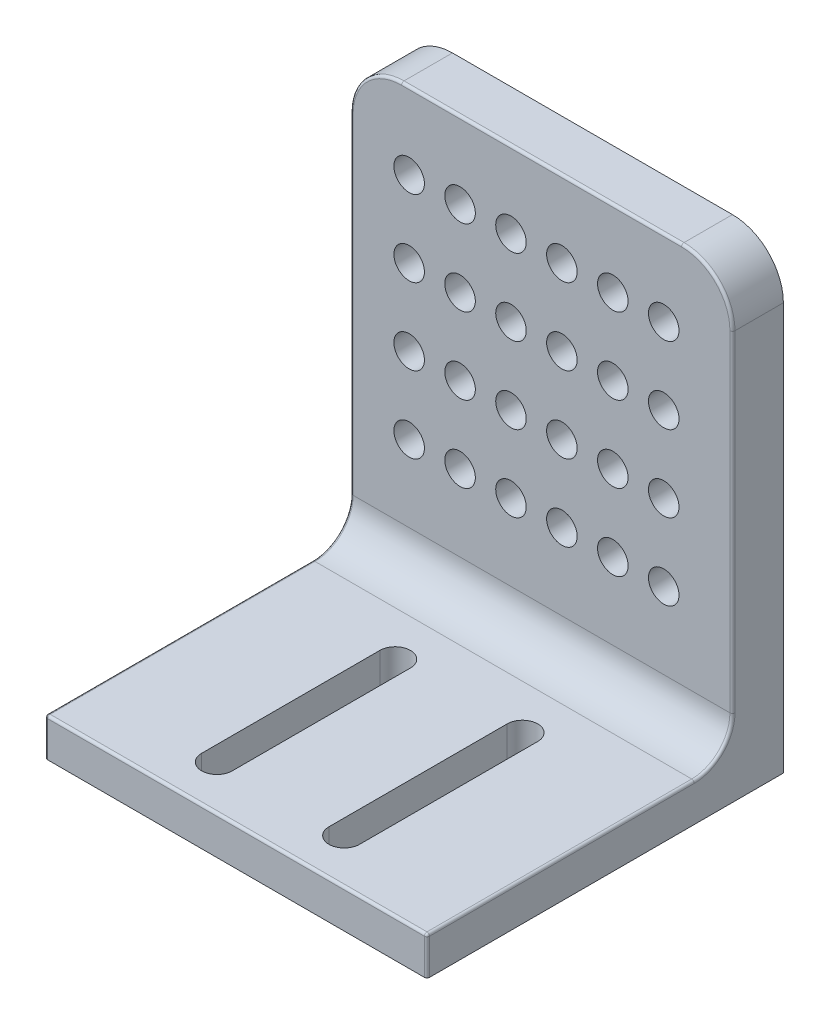
from build123d import *

# Parameters (mm, degrees)
SKETCH1_W           = 75
SKETCH1_H           = 90
BOSS_EXTRUDE1_DEPTH = 10
FILLET1_R           = 10
SKETCH3_W           = 75
SKETCH3_H           = 7.5
BOSS_EXTRUDE2_DEPTH = 60
FILLET2_R           = 7.5
SKETCH2_R           = 3
CUT_EXTRUDE1_DEPTH  = 10
CUT_EXTRUDE2_DEPTH  = 10
FILLET3_R           = 0.5
FILLET4_R           = 0.5


with BuildPart() as part:
    # Sketch1 → Boss-Extrude1 (new body)
    with BuildSketch(Plane.XY):
        Rectangle(SKETCH1_W, SKETCH1_H)
    extrude(amount=BOSS_EXTRUDE1_DEPTH)

    # Fillet1
    fillet1_edges = [part.edges().sort_by_distance(p)[0] for p in [
        (-37.5, 45, 5),
        (37.5, 45, 5),
    ]]
    fillet(fillet1_edges, radius=FILLET1_R)

    # Sketch3 → Boss-Extrude2 (add)
    with BuildSketch(Plane.XY.offset(10)):
        with Locations((0, -41.25)):
            Rectangle(SKETCH3_W, SKETCH3_H)
    extrude(amount=BOSS_EXTRUDE2_DEPTH)

    # Fillet2
    fillet2_edges = [part.edges().sort_by_distance(p)[0] for p in [
        (0, -37.5, 10),
    ]]
    fillet(fillet2_edges, radius=FILLET2_R)

    # Sketch2 → Cut-Extrude1 (cut)
    with BuildSketch(Plane.XY):
        with Locations(Location((23.999417703, 30, 0), (0, 0, 180))):
            Circle(SKETCH2_R)
        with Locations(Location((13.999417703, 30, 0), (0, 0, 180))):
            Circle(SKETCH2_R)
        with Locations(Location((3.999417703, 30, 0), (0, 0, 180))):
            Circle(SKETCH2_R)
        with Locations(Location((-6.000582297, 30, 0), (0, 0, 180))):
            Circle(SKETCH2_R)
        with Locations(Location((-16.000582297, 30, 0), (0, 0, 180))):
            Circle(SKETCH2_R)
        with Locations(Location((-26.000582297, 30, 0), (0, 0, 180))):
            Circle(SKETCH2_R)
        with Locations(Location((13.999417703, 15, 0), (0, 0, 180))):
            Circle(SKETCH2_R)
        with Locations(Location((3.999417703, 15, 0), (0, 0, 180))):
            Circle(SKETCH2_R)
        with Locations(Location((-6.000582297, 15, 0), (0, 0, 180))):
            Circle(SKETCH2_R)
        with Locations(Location((-16.000582297, 15, 0), (0, 0, 180))):
            Circle(SKETCH2_R)
        with Locations(Location((-26.000582297, 15, 0), (0, 0, 180))):
            Circle(SKETCH2_R)
        with Locations(Location((13.999417703, 0, 0), (0, 0, 180))):
            Circle(SKETCH2_R)
        with Locations(Location((3.999417703, 0, 0), (0, 0, 180))):
            Circle(SKETCH2_R)
        with Locations(Location((-6.000582297, 0, 0), (0, 0, 180))):
            Circle(SKETCH2_R)
        with Locations(Location((-16.000582297, 0, 0), (0, 0, 180))):
            Circle(SKETCH2_R)
        with Locations(Location((-26.000582297, 0, 0), (0, 0, 180))):
            Circle(SKETCH2_R)
        with Locations(Location((13.999417703, -15, 0), (0, 0, 180))):
            Circle(SKETCH2_R)
        with Locations(Location((3.999417703, -15, 0), (0, 0, 180))):
            Circle(SKETCH2_R)
        with Locations(Location((-6.000582297, -15, 0), (0, 0, 180))):
            Circle(SKETCH2_R)
        with Locations(Location((-16.000582297, -15, 0), (0, 0, 180))):
            Circle(SKETCH2_R)
        with Locations(Location((-26.000582297, -15, 0), (0, 0, 180))):
            Circle(SKETCH2_R)
        with Locations(Location((23.999417703, 15, 0), (0, 0, 180))):
            Circle(SKETCH2_R)
        with Locations(Location((23.999417703, 0, 0), (0, 0, 180))):
            Circle(SKETCH2_R)
        with Locations(Location((23.999417703, -15, 0), (0, 0, 180))):
            Circle(SKETCH2_R)
    extrude(amount=CUT_EXTRUDE1_DEPTH, mode=Mode.SUBTRACT)

    # Sketch4 → Cut-Extrude2 (cut)
    with BuildSketch(Plane(origin=(0, -37.5, 0), x_dir=(1, 0, 0), z_dir=(0, 1, 0))):
        with BuildLine():
            Line((-9.5, -26.25), (-9.5, -61.25))
            ThreePointArc((-9.5, -61.25), (-12.5, -64.25), (-15.5, -61.25))
            Line((-15.5, -61.25), (-15.5, -26.25))
            ThreePointArc((-15.5, -26.25), (-12.5, -23.25), (-9.5, -26.25))
        make_face()
        with BuildLine():
            Line((9.5, -26.25), (9.5, -61.25))
            ThreePointArc((9.5, -61.25), (12.5, -64.25), (15.5, -61.25))
            Line((15.5, -61.25), (15.5, -26.25))
            ThreePointArc((15.5, -26.25), (12.5, -23.25), (9.5, -26.25))
        make_face()
    extrude(amount=-CUT_EXTRUDE2_DEPTH, mode=Mode.SUBTRACT)

    # Fillet3
    fillet3_edges = [part.edges().sort_by_distance(p)[0] for p in [
        (0, -37.5, 70),
    ]]
    fillet(fillet3_edges, radius=FILLET3_R)

    # Fillet4
    fillet4_edges = [part.edges().sort_by_distance(p)[0] for p in [
        (0, 45, 10),
        (-37.5, 2.5, 10),
        (-34.571067812, 42.071067812, 10),
        (-37.5, -41.5, 70),
        (-37.5, -37.5, 43.5),
        (-37.5, -37.646446609, 69.853553391),
        (37.5, -37.5, 43.5),
        (37.5, -37.646446609, 69.853553391),
        (34.571067812, 42.071067812, 10),
        (37.5, -41.5, 70),
        (37.5, 2.5, 10),
        (-37.5, -35.303300859, 12.196699141),
        (37.5, -35.303300859, 12.196699141),
    ]]
    fillet(fillet4_edges, radius=FILLET4_R)


solid = part.part
